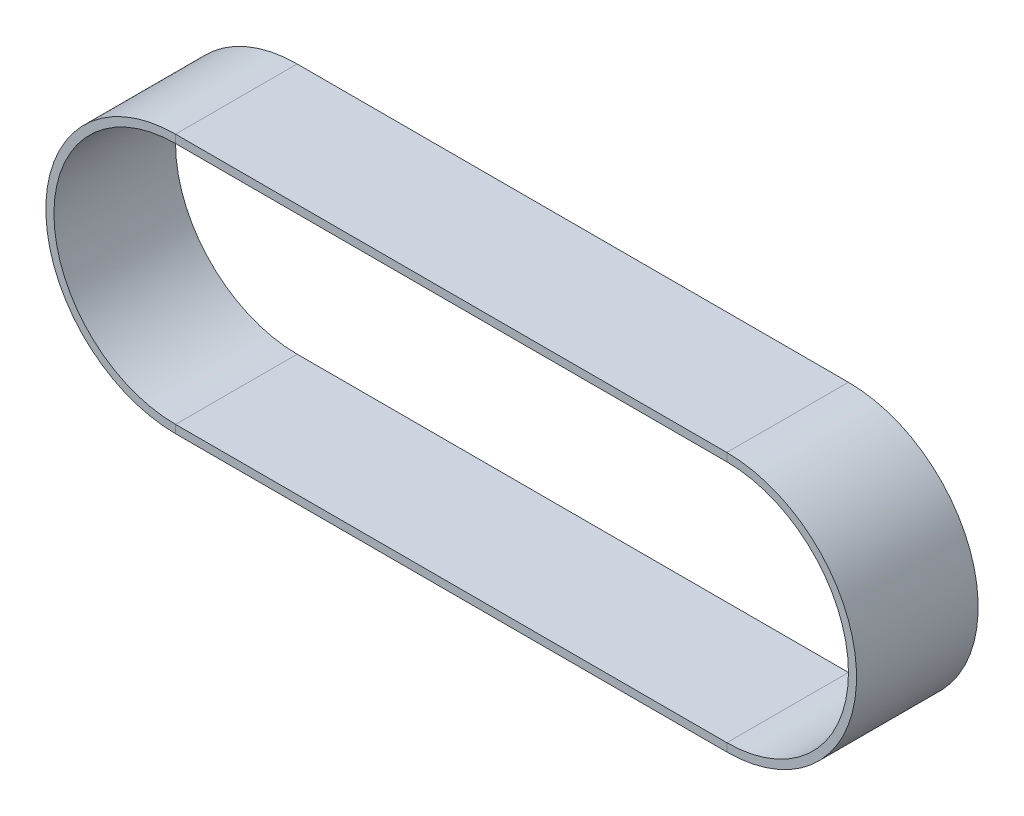
from build123d import *


with BuildPart() as part:
    # Austragung1: sweep along a path in Skizze2
    with BuildLine(Plane.XY) as austragung1_path:
        Line((0, -300), (-1360, -300))
        ThreePointArc((-1360, -300), (-1660, 0), (-1360, 300))
        Line((-1360, 300), (0, 300))
        ThreePointArc((0, 300), (300, 0), (0, -300))
    # 3D-Skizze1 → Austragung1 (sweep)
    with BuildSketch(Plane(origin=(0, 320, 150), x_dir=(0, -0.066519010523774, -0.997785157856609), z_dir=(1, 0, 0))):
        Polygon((0, 0), (299.335547357, 19.955703157), (300.665927567, 0), (1.33038021, -19.955703157), align=None)
    sweep(path=austragung1_path.line)


solid = part.part
